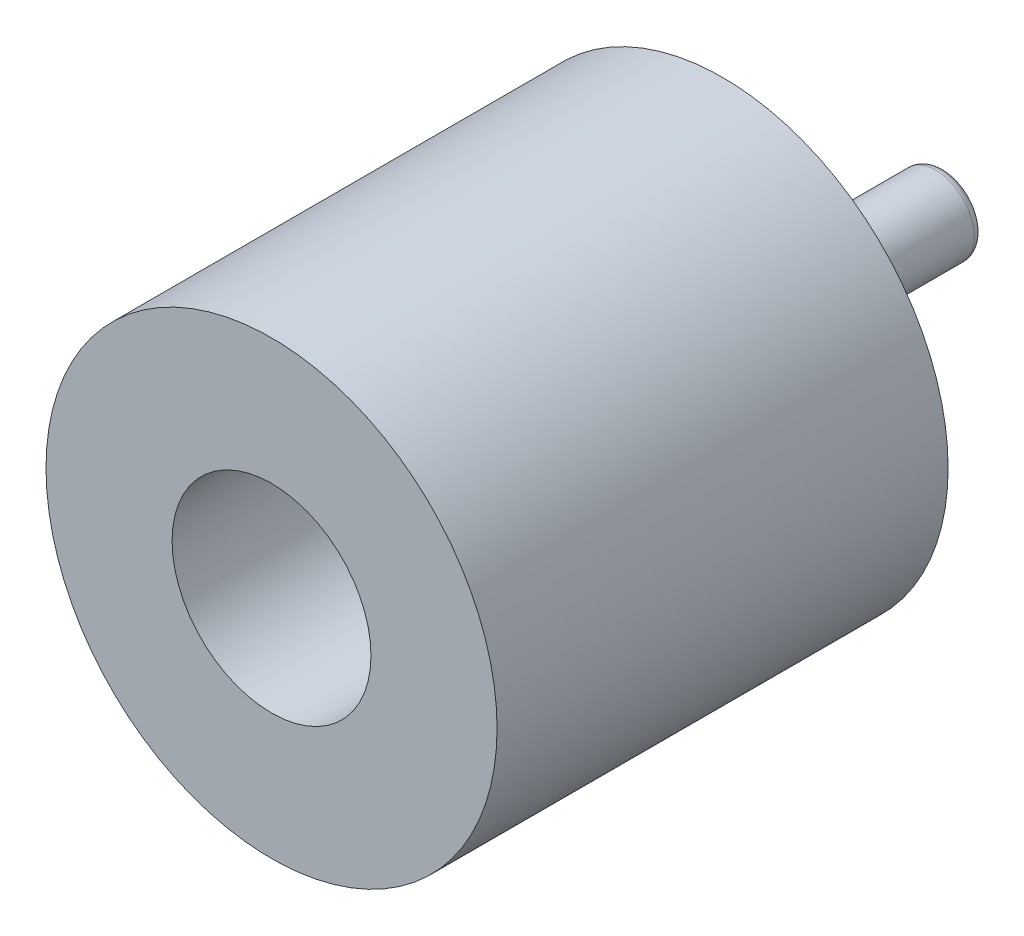
from build123d import *

# Parameters (mm, degrees)
SKETCH1_R           = 2.54
BOSS_EXTRUDE1_DEPTH = 5.08
SKETCH2_R           = 1.12
CUT_EXTRUDE1_DEPTH  = 3
SKETCH3_R           = 0.435
BOSS_EXTRUDE2_DEPTH = 2.5
FILLET1_R           = 0.1
FILLET2_R           = 0.1


with BuildPart() as part:
    # Sketch1 → Boss-Extrude1 (new body)
    with BuildSketch(Plane.XY):
        Circle(SKETCH1_R)
    extrude(amount=BOSS_EXTRUDE1_DEPTH)

    # Sketch2 → Cut-Extrude1 (cut)
    with BuildSketch(Plane.XY.offset(5.08)):
        Circle(SKETCH2_R)
    extrude(amount=-CUT_EXTRUDE1_DEPTH, mode=Mode.SUBTRACT)

    # Sketch3 → Boss-Extrude2 (add)
    with BuildSketch(Plane(origin=(0, 0, 0), x_dir=(-1, 0, 0), z_dir=(0, 0, -1))):
        Circle(SKETCH3_R)
    extrude(amount=BOSS_EXTRUDE2_DEPTH)

    # Fillet1
    fillet1_edges = [part.edges().sort_by_distance(p)[0] for p in [
        (0.435, 0, 0),
    ]]
    fillet(fillet1_edges, radius=FILLET1_R)

    # Fillet2
    fillet2_edges = [part.edges().sort_by_distance(p)[0] for p in [
        (0.435, 0, -2.5),
    ]]
    fillet(fillet2_edges, radius=FILLET2_R)


solid = part.part
